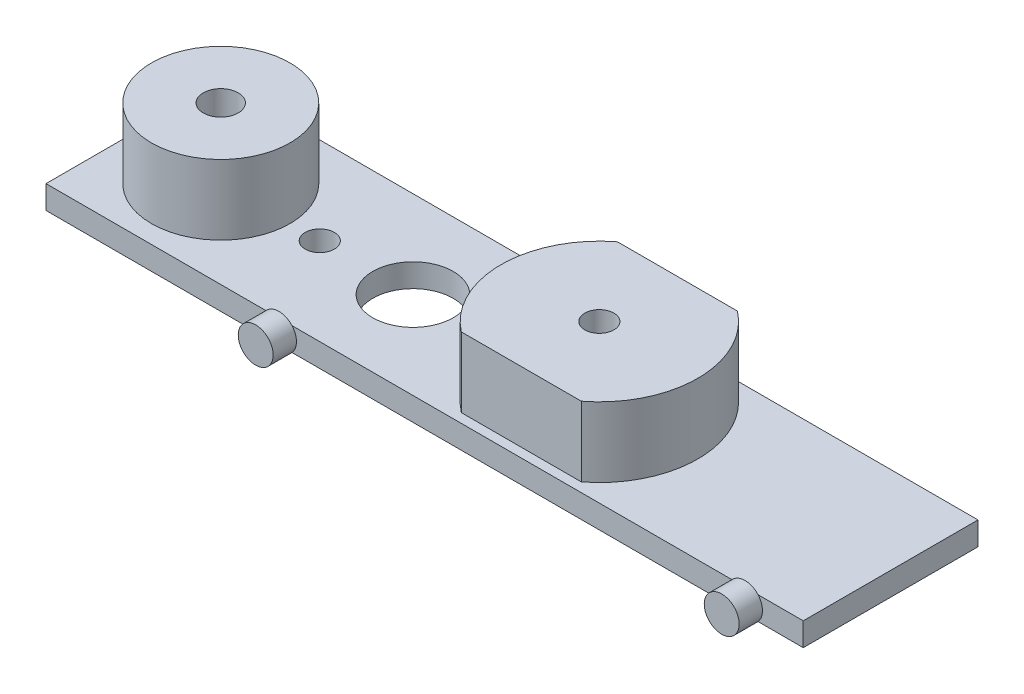
from build123d import *

# Parameters (mm, degrees)
SKETCH_1_W               = 65
SKETCH_1_H               = 15
EXTRUDE_1_DEPTH          = 2
SKETCH_2_R               = 1.25
SKETCH_2_R_2             = 3.45
SKETCH_2_R_3             = 1.5
CUT_EXTRUDE_1_DEPTH      = 2
SKETCH_4_R               = 1.5
EXTRUDE_2_DEPTH          = 2
SKETCH_5_R               = 5.95
SKETCH_5_R_2             = 5.25
EXTRUDE_3_DEPTH          = 6
SKETCH_5_8_R             = 1.25
SKETCH_5_8_R_2           = 5.25
EXTRUDE_4_DEPTH          = 6
CUT_EXTRUDE_2_DEPTH      = 3.5
CUT_EXTRUDE_2_DEPTH_BACK = 42.548164821
SKETCH_5_11_R            = 1.25
SKETCH_5_11_R_2          = 5.25
SKETCH_2_3_R             = 1.5
CUT_EXTRUDE_3_DEPTH      = 8


with BuildPart() as part:
    # 草图1 → 凸台-拉伸1 (new body)
    with BuildSketch(Plane(origin=(0, 0, 0), x_dir=(1, 0, 0), z_dir=(0, 1, 0))):
        with Locations((-7.5, 0)):
            Rectangle(SKETCH_1_W, SKETCH_1_H)
    extrude(amount=EXTRUDE_1_DEPTH)

    # 草图2 → 切除-拉伸1 (cut)
    with BuildSketch(Plane(origin=(0, 0, 0), x_dir=(1, 0, 0), z_dir=(0, 1, 0))):
        with Locations(Location((0, 0, 0), (0, 0, 270))):
            Circle(SKETCH_2_R)
        with Locations(Location((-16, 0, 0), (0, 0, 90))):
            Circle(SKETCH_2_R_2)
        with Locations(Location((-24, 0, 0), (0, 0, 90))):
            Circle(SKETCH_2_R)
        with Locations(Location((-32.5, 0, 0), (0, 0, 270))):
            Circle(SKETCH_2_R_3)
    extrude(amount=CUT_EXTRUDE_1_DEPTH, mode=Mode.SUBTRACT)

    # 草图4 → 凸台-拉伸2 (add)
    with BuildSketch(Plane.XY.offset(7.5)):
        with Locations(Location((20, 1, 0), (0, 0, 221.810314896))):
            Circle(SKETCH_4_R)
        with Locations(Location((-20, 1, 0), (0, 0, 221.810314896))):
            Circle(SKETCH_4_R)
    extrude(amount=EXTRUDE_2_DEPTH)

    # 草图5 → 凸台-拉伸3 (add)
    # profile 1 of 2: a face of its own
    with BuildSketch(Plane(origin=(0, 2, 0), x_dir=(1, 0, 0), z_dir=(0, 1, 0))):
        with Locations(Location((-32.5, 0, 0), (0, 0, 270))):
            Circle(SKETCH_5_R)
        with Locations(Location((-32.5, 0, 0), (0, 0, 270))):
            Circle(SKETCH_5_R_2, mode=Mode.SUBTRACT)
    # profile 2 of 2: a face of its own
    with BuildSketch(Plane(origin=(0, 2, 0), x_dir=(1, 0, 0), z_dir=(0, 1, 0))):
        with BuildLine():
            Line((5.149029035, -6.7), (-5.149029035, -6.7))
            ThreePointArc((-5.149029035, -6.7), (-8.45, 0), (-5.149029035, 6.7))
            Line((-5.149029035, 6.7), (5.149029035, 6.7))
            ThreePointArc((5.149029035, 6.7), (8.45, 0), (5.149029035, -6.7))
        make_face()
        with BuildLine():
            Line((4.905354218, -6), (-4.905354218, -6))
            ThreePointArc((-4.905354218, -6), (-7.75, 0), (-4.905354218, 6))
            Line((-4.905354218, 6), (4.905354218, 6))
            ThreePointArc((4.905354218, 6), (7.75, 0), (4.905354218, -6))
        make_face(mode=Mode.SUBTRACT)
    extrude(amount=EXTRUDE_3_DEPTH)

    # 草图5<8> → 凸台-拉伸4 (add)
    # profile 1 of 2: a face of its own
    with BuildSketch(Plane(origin=(0, 2, 0), x_dir=(1, 0, 0), z_dir=(0, 1, 0))):
        with BuildLine():
            Line((4.905354218, -6), (-4.905354218, -6))
            ThreePointArc((-4.905354218, -6), (-7.75, 0), (-4.905354218, 6))
            Line((-4.905354218, 6), (4.905354218, 6))
            ThreePointArc((4.905354218, 6), (7.75, 0), (4.905354218, -6))
        make_face()
        with Locations(Location((0, 0, 0), (0, 0, 270))):
            Circle(SKETCH_5_8_R, mode=Mode.SUBTRACT)
    # profile 2 of 2: a face of its own
    with BuildSketch(Plane(origin=(0, 2, 0), x_dir=(1, 0, 0), z_dir=(0, 1, 0))):
        with Locations((-32.5, 0)):
            Circle(SKETCH_5_8_R_2)
    extrude(amount=EXTRUDE_4_DEPTH)

    # 草图5<11> → 切除-拉伸2 (cut, two sides: drawn at the far end of the back side and taken through both)
    # profile 1 of 2: a face of its own
    with BuildSketch(Plane(origin=(0, 2, 0), x_dir=(1, 0, 0), z_dir=(0, 1, 0)).offset(-CUT_EXTRUDE_2_DEPTH_BACK)):
        with BuildLine():
            Line((4.905354218, -6), (-4.905354218, -6))
            ThreePointArc((-4.905354218, -6), (-7.75, 0), (-4.905354218, 6))
            Line((-4.905354218, 6), (4.905354218, 6))
            ThreePointArc((4.905354218, 6), (7.75, 0), (4.905354218, -6))
        make_face()
        with Locations(Location((0, 0, 0), (0, 0, 270))):
            Circle(SKETCH_5_11_R, mode=Mode.SUBTRACT)
    # profile 2 of 2: a face of its own
    with BuildSketch(Plane(origin=(0, 2, 0), x_dir=(1, 0, 0), z_dir=(0, 1, 0)).offset(-CUT_EXTRUDE_2_DEPTH_BACK)):
        with Locations(Location((-32.5, 0, 0), (0, 0, 270))):
            Circle(SKETCH_5_11_R_2)
    extrude(amount=CUT_EXTRUDE_2_DEPTH + CUT_EXTRUDE_2_DEPTH_BACK, mode=Mode.SUBTRACT)

    # 草图2<3> → 切除-拉伸3 (cut)
    with BuildSketch(Plane(origin=(0, 0, 0), x_dir=(1, 0, 0), z_dir=(0, 1, 0))):
        with Locations(Location((-32.5, 0, 0), (0, 0, 270))):
            Circle(SKETCH_2_3_R)
    extrude(amount=CUT_EXTRUDE_3_DEPTH, mode=Mode.SUBTRACT)


solid = part.part
